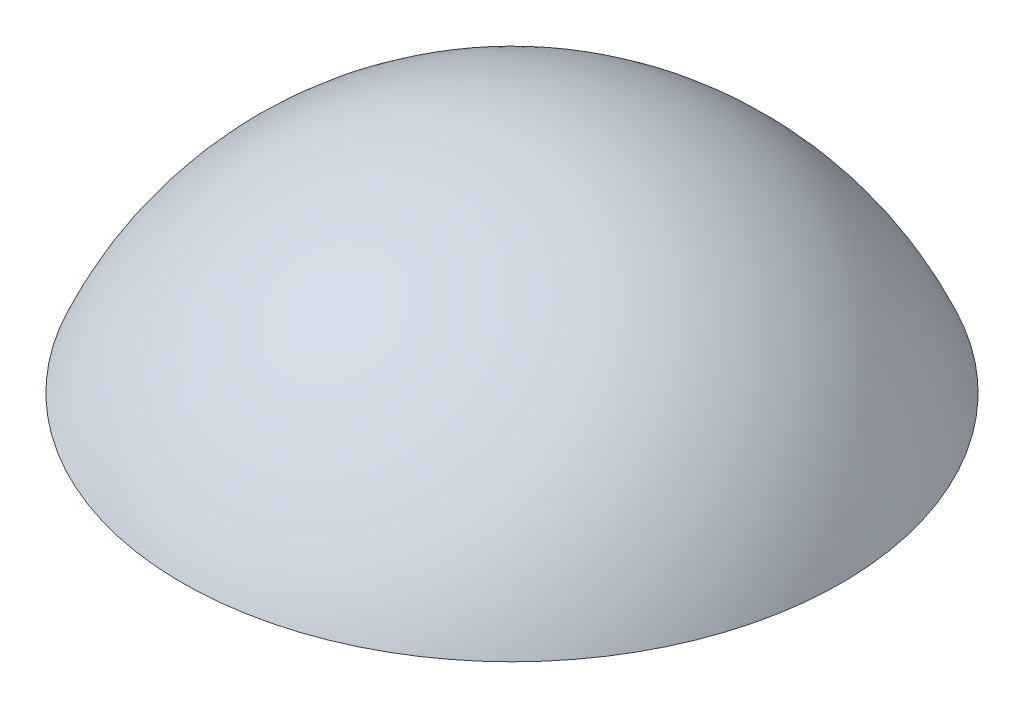
from build123d import *


with BuildPart() as part:
    # Sketch1 → Revolve1 (revolve)
    with BuildSketch(Plane.XY):
        with BuildLine():
            Line((-3, 1.247518969), (0, 1.247518969))
            Line((0, 1.247518969), (0, 3.249046564))
            ThreePointArc((0, 3.249046564), (-1.803199429, 2.7027348), (-3, 1.247518969))
        make_face()
    revolve(axis=Axis((0, 1.247518969, 0), (0, 1, 0)))


solid = part.part
